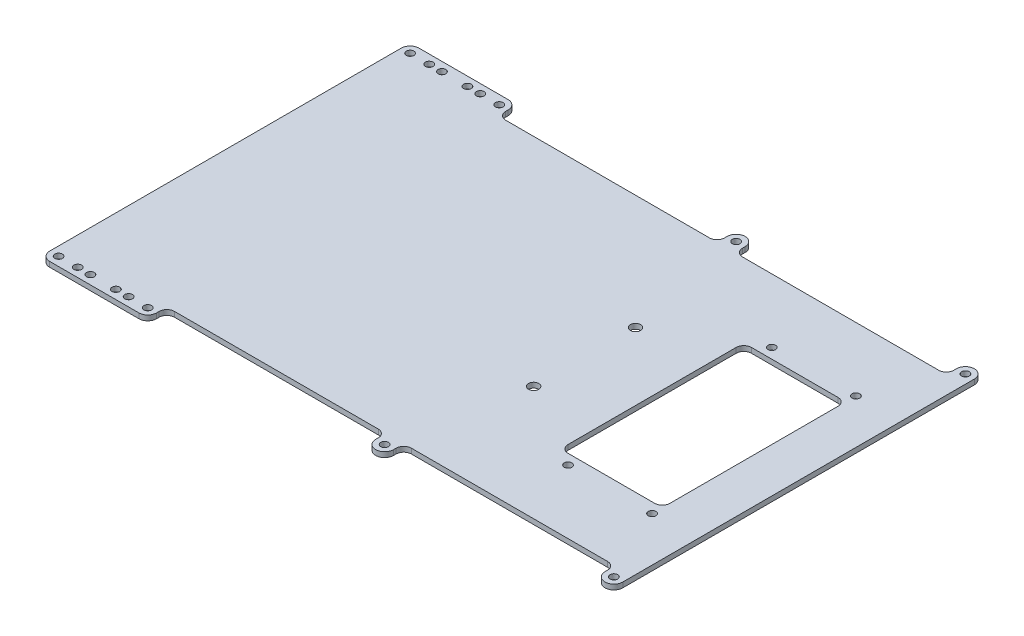
from build123d import *

# Parameters (mm, degrees)
SKETCH1_W           = 225
SKETCH1_H           = 145
SKETCH1_R           = 1.5
SKETCH1_R_2         = 2
SKETCH1_W_2         = 40
SKETCH1_H_2         = 72
BOSS_EXTRUDE1_DEPTH = 2
SKETCH3_R           = 1.5
CUT_EXTRUDE1_DEPTH  = 10
FILLET3_R           = 3
FILLET4_R           = 3
FILLET5_R           = 3.5


with BuildPart() as part:
    # Sketch1 → Boss-Extrude1 (new body)
    with BuildSketch(Plane(origin=(0, 0, 0), x_dir=(1, 0, 0), z_dir=(0, 1, 0))):
        with Locations((16.5, 0)):
            Rectangle(SKETCH1_W, SKETCH1_H)
        with Locations(Location((-85, 69, 0), (0, 0, 270))):
            Circle(SKETCH1_R, mode=Mode.SUBTRACT)
        with Locations(Location((-65, 69, 0), (0, 0, 270))):
            Circle(SKETCH1_R, mode=Mode.SUBTRACT)
        with Locations(Location((-85, -69, 0), (0, 0, 90))):
            Circle(SKETCH1_R, mode=Mode.SUBTRACT)
        with Locations(Location((-65, -69, 0), (0, 0, 90))):
            Circle(SKETCH1_R, mode=Mode.SUBTRACT)
        with Locations(Location((45, 20, 0), (0, 0, 270))):
            Circle(SKETCH1_R_2, mode=Mode.SUBTRACT)
        with Locations(Location((45, -20, 0), (0, 0, 270))):
            Circle(SKETCH1_R_2, mode=Mode.SUBTRACT)
        with Locations(Location((-80, 69, 0), (0, 0, 270))):
            Circle(SKETCH1_R, mode=Mode.SUBTRACT)
        with Locations(Location((-70, 69, 0), (0, 0, 270))):
            Circle(SKETCH1_R, mode=Mode.SUBTRACT)
        with Locations(Location((-80, -69, 0), (0, 0, 270))):
            Circle(SKETCH1_R, mode=Mode.SUBTRACT)
        with Locations(Location((-70, -69, 0), (0, 0, 270))):
            Circle(SKETCH1_R, mode=Mode.SUBTRACT)
        with Locations(Location((78.5, -40, 0), (0, 0, 270))):
            Circle(SKETCH1_R, mode=Mode.SUBTRACT)
        with Locations(Location((111.5, -40, 0), (0, 0, 270))):
            Circle(SKETCH1_R, mode=Mode.SUBTRACT)
        with Locations(Location((111.5, 40, 0), (0, 0, 270))):
            Circle(SKETCH1_R, mode=Mode.SUBTRACT)
        with Locations(Location((78.5, 40, 0), (0, 0, 270))):
            Circle(SKETCH1_R, mode=Mode.SUBTRACT)
        with Locations(Location((-92.5, -69, 0), (0, 0, 270))):
            Circle(SKETCH1_R, mode=Mode.SUBTRACT)
        with Locations(Location((-57.5, -69, 0), (0, 0, 270))):
            Circle(SKETCH1_R, mode=Mode.SUBTRACT)
        with Locations(Location((-92.5, 69, 0), (0, 0, 270))):
            Circle(SKETCH1_R, mode=Mode.SUBTRACT)
        with Locations(Location((-57.5, 69, 0), (0, 0, 270))):
            Circle(SKETCH1_R, mode=Mode.SUBTRACT)
        with Locations((91.5, 0)):
            Rectangle(SKETCH1_W_2, SKETCH1_H_2, mode=Mode.SUBTRACT)
    extrude(amount=BOSS_EXTRUDE1_DEPTH)

    # Sketch3 → Cut-Extrude1 (cut)
    with BuildSketch(Plane(origin=(0, 2, 0), x_dir=(1, 0, 0), z_dir=(0, 1, 0))):
        with BuildLine():
            Line((-54, -72.5), (35.500000021, -72.5))
            ThreePointArc((35.500000021, -72.5), (33.025126273, -71.474873741), (32, -69))
            Line((32, -69), (32, -65))
            Line((32, -65), (-54, -65))
            Line((-54, -65), (-54, -72.5))
        make_face()
        with BuildLine():
            Line((122, -69), (122, -65))
            Line((122, -65), (39, -65))
            Line((39, -65), (39, -69))
            ThreePointArc((39, -69), (37.974873741, -71.474873727), (35.500000021, -72.5))
            Line((35.500000021, -72.5), (125.499999987, -72.5))
            ThreePointArc((125.499999987, -72.5), (123.025126261, -71.47487373), (122, -69))
        make_face()
        with BuildLine():
            Line((35.5, 72.5), (-54, 72.5))
            Line((-54, 72.5), (-54, 65))
            Line((-54, 65), (32, 65))
            Line((32, 65), (32, 69))
            ThreePointArc((32, 69), (33.025126266, 71.474873734), (35.5, 72.5))
        make_face()
        with BuildLine():
            Line((125.5, 72.5), (35.5, 72.5))
            ThreePointArc((35.5, 72.5), (37.974873734, 71.474873734), (39, 69))
            Line((39, 69), (39, 65))
            Line((39, 65), (122, 65))
            Line((122, 65), (122, 69))
            ThreePointArc((122, 69), (123.025126266, 71.474873734), (125.5, 72.5))
        make_face()
        with BuildLine():
            Line((129, 72.5), (125.5, 72.5))
            ThreePointArc((125.5, 72.5), (127.974873734, 71.474873734), (129, 69))
            Line((129, 69), (129, 72.5))
        make_face()
        with Locations(Location((125.5, 69, 0), (0, 0, 270))):
            Circle(SKETCH3_R)
        with Locations(Location((35.5, 69, 0), (0, 0, 270))):
            Circle(SKETCH3_R)
        with Locations(Location((35.5, -69, 0), (0, 0, 270))):
            Circle(SKETCH3_R)
        with BuildLine():
            Line((129, -72.5), (129, -69))
            ThreePointArc((129, -69), (127.97487373, -71.474873739), (125.499999987, -72.5))
            Line((125.499999987, -72.5), (129, -72.5))
        make_face()
        with Locations(Location((125.5, -69, 0), (0, 0, 270))):
            Circle(SKETCH3_R)
    extrude(amount=-CUT_EXTRUDE1_DEPTH, mode=Mode.SUBTRACT)

    # Fillet3
    fillet3_edges = [part.edges().sort_by_distance(p)[0] for p in [
        (71.5, 1, -36),
        (71.5, 1, 36),
        (111.5, 1, 36),
        (111.5, 1, -36),
    ]]
    fillet(fillet3_edges, radius=FILLET3_R)

    # Fillet4
    fillet4_edges = [part.edges().sort_by_distance(p)[0] for p in [
        (-54, 1, 65),
        (32, 1, 65),
        (122, 1, -65),
        (39, 1, -65),
        (39, 1, 65),
        (122, 1, 65),
        (32, 1, -65),
        (-54, 1, -65),
    ]]
    fillet(fillet4_edges, radius=FILLET4_R)

    # Fillet5
    fillet5_edges = [part.edges().sort_by_distance(p)[0] for p in [
        (-54, 1, 72.5),
        (-54, 1, -72.5),
        (-96, 1, -72.5),
        (-96, 1, 72.5),
    ]]
    fillet(fillet5_edges, radius=FILLET5_R)


solid = part.part
